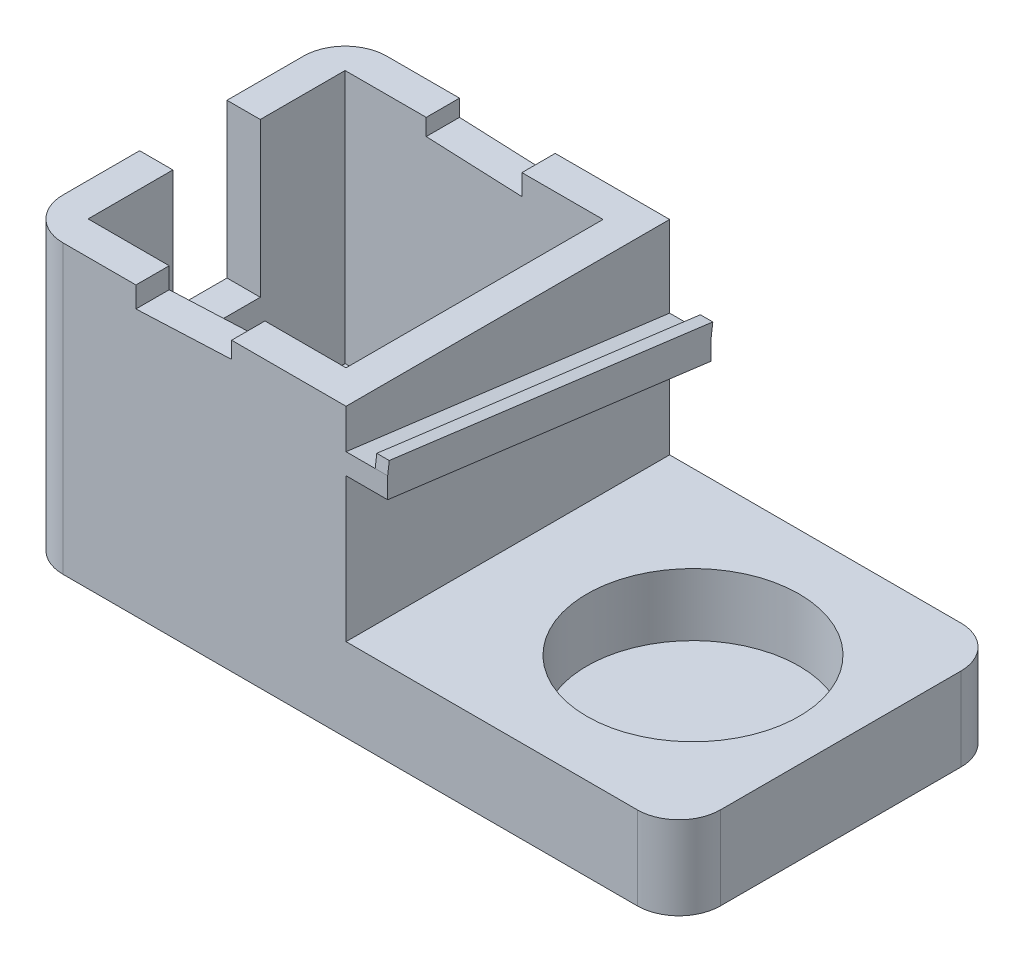
from build123d import *

# Parameters (mm, degrees)
SKETCH1_W            = 62
SKETCH1_H            = 61.770504471
BOSS_EXTRUDE6_DEPTH  = 8
SKETCH1_15_W         = 78
SKETCH1_15_H         = 77.770504471
SKETCH1_15_W_2       = 62
SKETCH1_15_H_2       = 61.770504471
BOSS_EXTRUDE9_DEPTH  = 69
SKETCH1_17_R         = 4
CUT_EXTRUDE2_DEPTH   = 56
SKETCH1_18_R         = 4
SKETCH1_18_R_2       = 2
BOSS_EXTRUDE10_DEPTH = 4
CUT_EXTRUDE10_DEPTH  = 8
CUT_EXTRUDE11_DEPTH  = 8
SKETCH6_W            = 21
SKETCH6_H            = 37
CUT_EXTRUDE13_DEPTH  = 10
SKETCH12_W           = 77.770504471
SKETCH12_H           = 20
BOSS_EXTRUDE12_DEPTH = 80
BOSS_EXTRUDE13_DEPTH = 10
SKETCH14_W           = 3
SKETCH14_H           = 78.415811308
BOSS_EXTRUDE14_DEPTH = 3
SKETCH15_R           = 25.5
CUT_EXTRUDE14_DEPTH  = 15
FILLET1_R            = 10


with BuildPart() as part:
    # Sketch1 → Boss-Extrude6 (new body)
    with BuildSketch(Plane(origin=(0, 0, 0), x_dir=(1, 0, 0), z_dir=(0, 1, 0))):
        with Locations((31, 30.885252236)):
            Rectangle(SKETCH1_W, SKETCH1_H)
    extrude(amount=BOSS_EXTRUDE6_DEPTH)

    # Sketch1<15> → Boss-Extrude9 (add)
    with BuildSketch(Plane(origin=(0, 0, 0), x_dir=(1, 0, 0), z_dir=(0, 1, 0))):
        with Locations((31, 30.885252236)):
            Rectangle(SKETCH1_15_W, SKETCH1_15_H)
        with Locations((31, 30.885252236)):
            Rectangle(SKETCH1_15_W_2, SKETCH1_15_H_2, mode=Mode.SUBTRACT)
    extrude(amount=BOSS_EXTRUDE9_DEPTH)

    # Sketch1<17> → Cut-Extrude2 (cut)
    with BuildSketch(Plane(origin=(0, 0, 0), x_dir=(1, 0, 0), z_dir=(0, 1, 0))):
        with Locations((5.656854249, 56.113650222)):
            Circle(SKETCH1_17_R)
        with Locations((56.343145751, 56.113650222)):
            Circle(SKETCH1_17_R)
        with Locations((56.343145751, 5.656854249)):
            Circle(SKETCH1_17_R)
        with Locations((5.656854249, 5.656854249)):
            Circle(SKETCH1_17_R)
    extrude(amount=CUT_EXTRUDE2_DEPTH, mode=Mode.SUBTRACT)

    # Sketch1<18> → Boss-Extrude10 (add)
    # profile 1 of 4: a face of its own
    with BuildSketch(Plane(origin=(0, 0, 0), x_dir=(1, 0, 0), z_dir=(0, 1, 0))):
        with Locations((5.656854249, 56.113650222)):
            Circle(SKETCH1_18_R)
        with Locations((5.656854249, 56.113650222)):
            Circle(SKETCH1_18_R_2, mode=Mode.SUBTRACT)
    # profile 2 of 4: a face of its own
    with BuildSketch(Plane(origin=(0, 0, 0), x_dir=(1, 0, 0), z_dir=(0, 1, 0))):
        with Locations((56.343145751, 56.113650222)):
            Circle(SKETCH1_18_R)
        with Locations((56.343145751, 56.113650222)):
            Circle(SKETCH1_18_R_2, mode=Mode.SUBTRACT)
    # profile 3 of 4: a face of its own
    with BuildSketch(Plane(origin=(0, 0, 0), x_dir=(1, 0, 0), z_dir=(0, 1, 0))):
        with Locations((56.343145751, 5.656854249)):
            Circle(SKETCH1_18_R)
        with Locations((56.343145751, 5.656854249)):
            Circle(SKETCH1_18_R_2, mode=Mode.SUBTRACT)
    # profile 4 of 4: a face of its own
    with BuildSketch(Plane(origin=(0, 0, 0), x_dir=(1, 0, 0), z_dir=(0, 1, 0))):
        with Locations((5.656854249, 5.656854249)):
            Circle(SKETCH1_18_R)
        with Locations((5.656854249, 5.656854249)):
            Circle(SKETCH1_18_R_2, mode=Mode.SUBTRACT)
    extrude(amount=BOSS_EXTRUDE10_DEPTH)

    # Sketch3 → Cut-Extrude10 (cut)
    with BuildSketch(Plane(origin=(0, 0, -69.770504471), x_dir=(-1, 0, 0), z_dir=(0, 0, -1))):
        Polygon((-42.5, 69), (-42.5, 64), (-19.5, 65), (-19.5, 69), align=None)
    extrude(amount=-CUT_EXTRUDE10_DEPTH, mode=Mode.SUBTRACT)

    # Sketch9 → Cut-Extrude11 (cut)
    with BuildSketch(Plane.XY.offset(8)):
        Polygon((19.5, 69), (19.5, 64), (42.5, 65), (42.5, 69), align=None)
    extrude(amount=-CUT_EXTRUDE11_DEPTH, mode=Mode.SUBTRACT)

    # Sketch6 → Cut-Extrude13 (cut)
    with BuildSketch(Plane.ZY.offset(8)):
        with Locations((-30.885252236, 50.5)):
            Rectangle(SKETCH6_W, SKETCH6_H)
    extrude(amount=-CUT_EXTRUDE13_DEPTH, mode=Mode.SUBTRACT)

    # Sketch12 → Boss-Extrude12 (add)
    with BuildSketch(Plane(origin=(70, 0, 0), x_dir=(0, 0, -1), z_dir=(1, 0, 0))):
        with Locations((30.885252236, 10)):
            Rectangle(SKETCH12_W, SKETCH12_H)
    extrude(amount=BOSS_EXTRUDE12_DEPTH)

    # Sketch13 → Boss-Extrude13 (add)
    with BuildSketch(Plane(origin=(70, 0, 0), x_dir=(0, 0, -1), z_dir=(1, 0, 0))):
        Polygon((-8, 59.539327542), (69.770504471, 49.5), (69.770504471, 44.5), (-8, 54.539327542), align=None)
    extrude(amount=BOSS_EXTRUDE13_DEPTH)

    # Sketch14 → Boss-Extrude14 (add)
    with BuildSketch(Plane(origin=(0, 57.547640196, -7.428775384), x_dir=(1, 0, 0), z_dir=(0, 0.9917707050815963, -0.12802682743063418))):
        with Locations((78.5, 23.651108801)):
            Rectangle(SKETCH14_W, SKETCH14_H)
    extrude(amount=BOSS_EXTRUDE14_DEPTH)

    # Sketch15 → Cut-Extrude14 (cut)
    with BuildSketch(Plane(origin=(0, 20, 0), x_dir=(1, 0, 0), z_dir=(0, 1, 0))):
        with Locations((114.5, 30.885252236)):
            Circle(SKETCH15_R)
    extrude(amount=-CUT_EXTRUDE14_DEPTH, mode=Mode.SUBTRACT)

    # Fillet1
    fillet1_edges = [part.edges().sort_by_distance(p)[0] for p in [
        (-8, 34.5, -69.770504471),
        (-8, 34.5, 8),
        (150, 10, -69.770504471),
        (150, 10, 8),
    ]]
    fillet(fillet1_edges, radius=FILLET1_R)


solid = part.part
